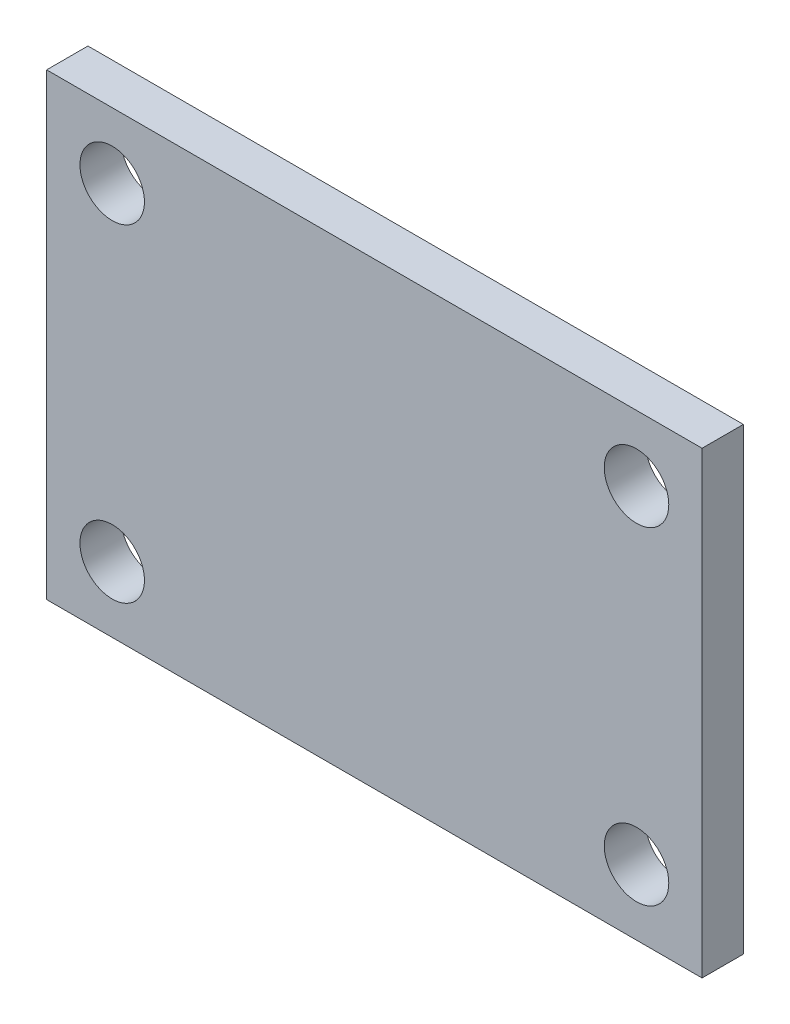
from build123d import *

# Parameters (mm, degrees)
PCB_25P4X17P78X1P6_M2P5_START     = -24.15
PCB_25P4X17P78X1P6_M2P5_PROFILE_W = 25.4
PCB_25P4X17P78X1P6_M2P5_PROFILE_H = 17.78
PCB_25P4X17P78X1P6_M2P5_PROFILE_R = 1.25
PCB_25P4X17P78X1P6_M2P5_DEPTH     = 1.6


with BuildPart() as part:
    # PCB_25p4x17p78x1p6_M2p5_Profile → PCB_25p4x17p78x1p6_M2p5 (new body)
    with BuildSketch(Plane.XY.offset(PCB_25P4X17P78X1P6_M2P5_START)):
        with Locations((12.5, 0)):
            Rectangle(PCB_25P4X17P78X1P6_M2P5_PROFILE_W, PCB_25P4X17P78X1P6_M2P5_PROFILE_H)
        with Locations((2.34, 6.35)):
            Circle(PCB_25P4X17P78X1P6_M2P5_PROFILE_R, mode=Mode.SUBTRACT)
        with Locations((22.66, 6.35)):
            Circle(PCB_25P4X17P78X1P6_M2P5_PROFILE_R, mode=Mode.SUBTRACT)
        with Locations((2.34, -6.35)):
            Circle(PCB_25P4X17P78X1P6_M2P5_PROFILE_R, mode=Mode.SUBTRACT)
        with Locations((22.66, -6.35)):
            Circle(PCB_25P4X17P78X1P6_M2P5_PROFILE_R, mode=Mode.SUBTRACT)
    extrude(amount=PCB_25P4X17P78X1P6_M2P5_DEPTH)


solid = part.part
